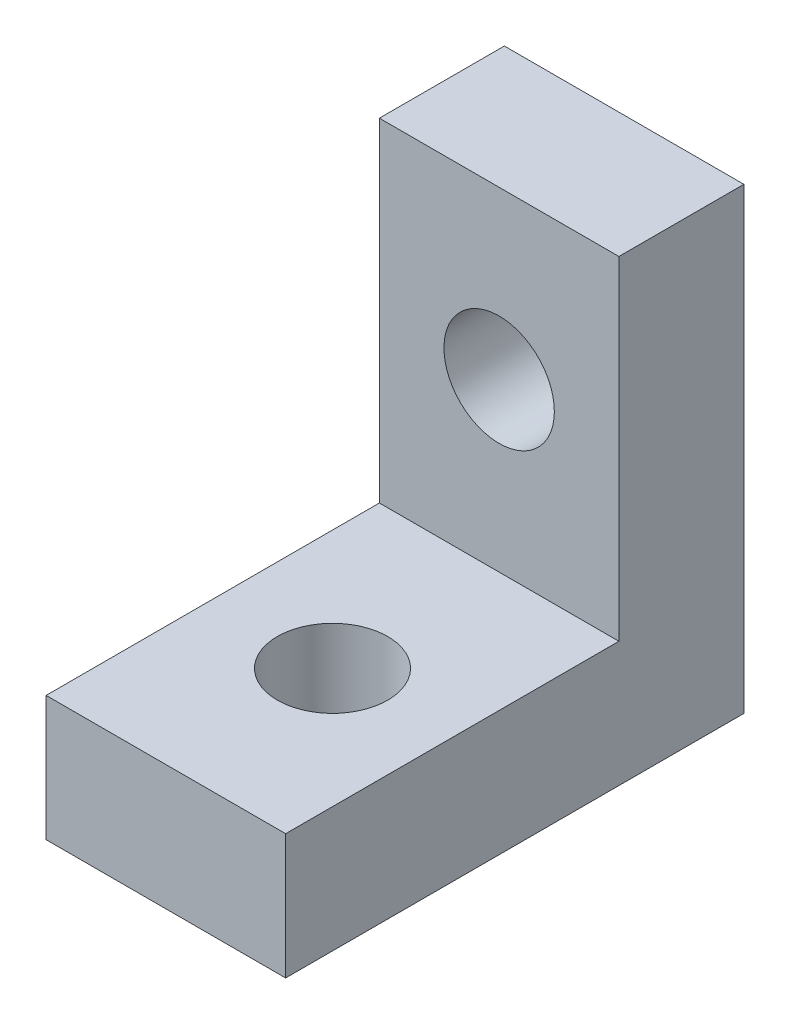
from build123d import *

# Parameters (mm, degrees)
BOSS_EXTRUDE1_DEPTH = 11.5
SKETCH2_R           = 2.65
CUT_EXTRUDE1_DEPTH  = 30.533878851
SKETCH3_R           = 2.65
CUT_EXTRUDE2_DEPTH  = 30.533878851


with BuildPart() as part:
    # Sketch1 → Boss-Extrude1 (new body)
    with BuildSketch(Plane(origin=(0, 0, 0), x_dir=(0, 0, -1), z_dir=(1, 0, 0))):
        Polygon((0, 0), (22, 0), (22, 22), (16, 22), (16, 6), (0, 6), align=None)
    extrude(amount=-BOSS_EXTRUDE1_DEPTH)

    # Sketch2 → Cut-Extrude1 (cut, through all)
    with BuildSketch(Plane(origin=(0, 6, 0), x_dir=(1, 0, 0), z_dir=(0, 1, 0))):
        with Locations(Location((-5.75, 8, 0), (0, 0, 270))):
            Circle(SKETCH2_R)
    extrude(amount=-CUT_EXTRUDE1_DEPTH, mode=Mode.SUBTRACT)

    # Sketch3 → Cut-Extrude2 (cut, through all)
    with BuildSketch(Plane.XY.offset(-16)):
        with Locations((-5.75, 14)):
            Circle(SKETCH3_R)
    extrude(amount=-CUT_EXTRUDE2_DEPTH, mode=Mode.SUBTRACT)


solid = part.part
